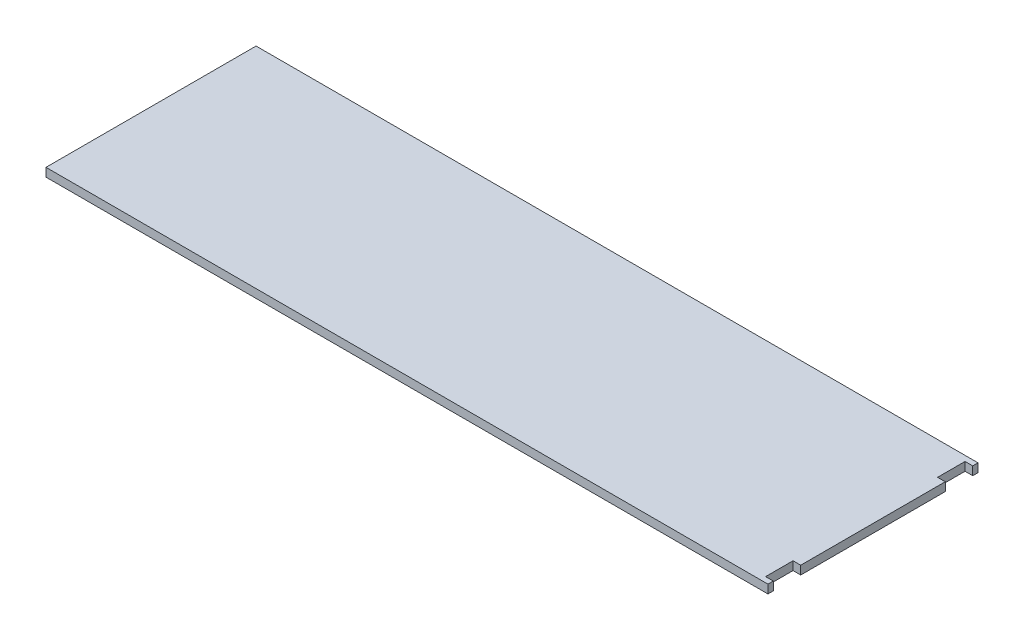
from build123d import *

# Parameters (mm, degrees)
SKETCH1_W           = 1074.7375
SKETCH1_H           = 312.7375
BOSS_EXTRUDE1_DEPTH = 12.7
SKETCH2_W           = 11.43
SKETCH2_H           = 40.894
CUT_EXTRUDE2_DEPTH  = 1045.207476152


with BuildPart() as part:
    # Sketch1 → Boss-Extrude1 (new body)
    with BuildSketch(Plane(origin=(0, 0, 0), x_dir=(1, 0, 0), z_dir=(0, 1, 0))):
        with Locations((465.275120786, 135.030000216)):
            Rectangle(SKETCH1_W, SKETCH1_H)
    extrude(amount=BOSS_EXTRUDE1_DEPTH)

    # Sketch2 → Cut-Extrude2 (cut, through all)
    with BuildSketch(Plane(origin=(0, 12.7, 0), x_dir=(1, 0, 0), z_dir=(0, 1, 0))):
        Polygon((1002.643870786, 283.550150216), (991.213870786, 283.550150216), (991.213870786, 242.656150216), (1002.643870786, 242.656150216), (1002.643870786, 253.768650216), align=None)
        with Locations((996.928870786, 7.045750216)):
            Rectangle(SKETCH2_W, SKETCH2_H)
    extrude(amount=-CUT_EXTRUDE2_DEPTH, mode=Mode.SUBTRACT)


solid = part.part
